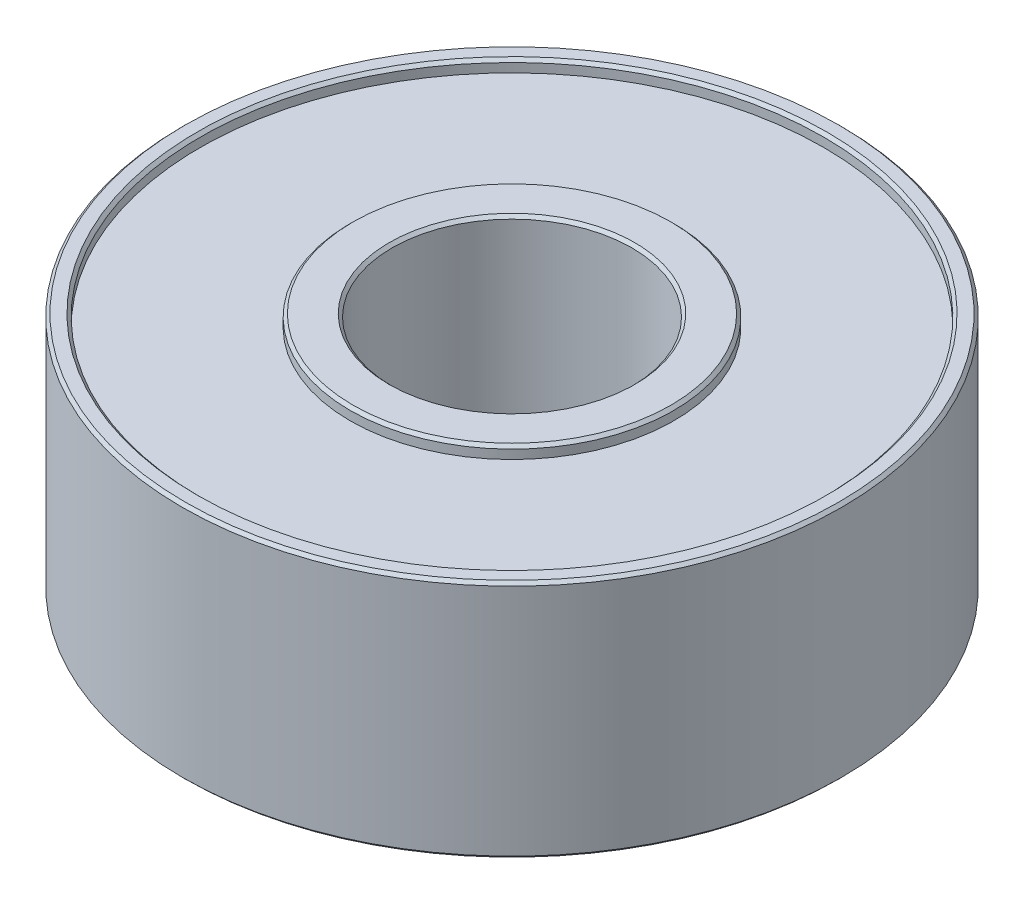
from build123d import *

# Parameters (mm, degrees)
SKETCH_1_R          = 5.5
SKETCH_1_R_2        = 2
EXTRUDE_1_DEPTH     = 4
SKETCH_2_R          = 5.2
SKETCH_2_R_2        = 2.7
CUT_EXTRUDE_1_DEPTH = 0.2
CUT_EXTRUDE_START   = -3.8
SKETCH_2_2_R        = 5.2
SKETCH_2_2_R_2      = 2.7
CUT_EXTRUDE_2_DEPTH = 5.946427842
CHAMFER_1_SIZE      = 0.05


with BuildPart() as part:
    # Эскиз1 → Бобышка-Вытянуть1 (new body)
    with BuildSketch(Plane(origin=(0, 0, 0), x_dir=(1, 0, 0), z_dir=(0, 1, 0))):
        Circle(SKETCH_1_R)
        Circle(SKETCH_1_R_2, mode=Mode.SUBTRACT)
    extrude(amount=EXTRUDE_1_DEPTH)

    # Эскиз2 → Вырез-Вытянуть1 (cut)
    with BuildSketch(Plane(origin=(0, 4, 0), x_dir=(1, 0, 0), z_dir=(0, 1, 0))):
        Circle(SKETCH_2_R)
        Circle(SKETCH_2_R_2, mode=Mode.SUBTRACT)
    extrude(amount=-CUT_EXTRUDE_1_DEPTH, mode=Mode.SUBTRACT)

    # Эскиз2<2> → Вырез-Вытянуть2 (cut, through all)
    with BuildSketch(Plane(origin=(0, 4, 0), x_dir=(1, 0, 0), z_dir=(0, 1, 0)).offset(CUT_EXTRUDE_START)):
        Circle(SKETCH_2_2_R)
        Circle(SKETCH_2_2_R_2, mode=Mode.SUBTRACT)
    extrude(amount=-CUT_EXTRUDE_2_DEPTH, mode=Mode.SUBTRACT)

    # Фаска1
    chamfer_1_edges = [part.edges().sort_by_distance(p)[0] for p in [
        (-2.7, 0, 0),
        (-2, 0, 0),
        (-5.5, 0, 0),
        (-5.2, 0, 0),
        (-2.7, 4, 0),
        (-2, 4, 0),
        (-5.5, 4, 0),
        (-5.2, 4, 0),
    ]]
    chamfer(chamfer_1_edges, length=CHAMFER_1_SIZE)


solid = part.part
